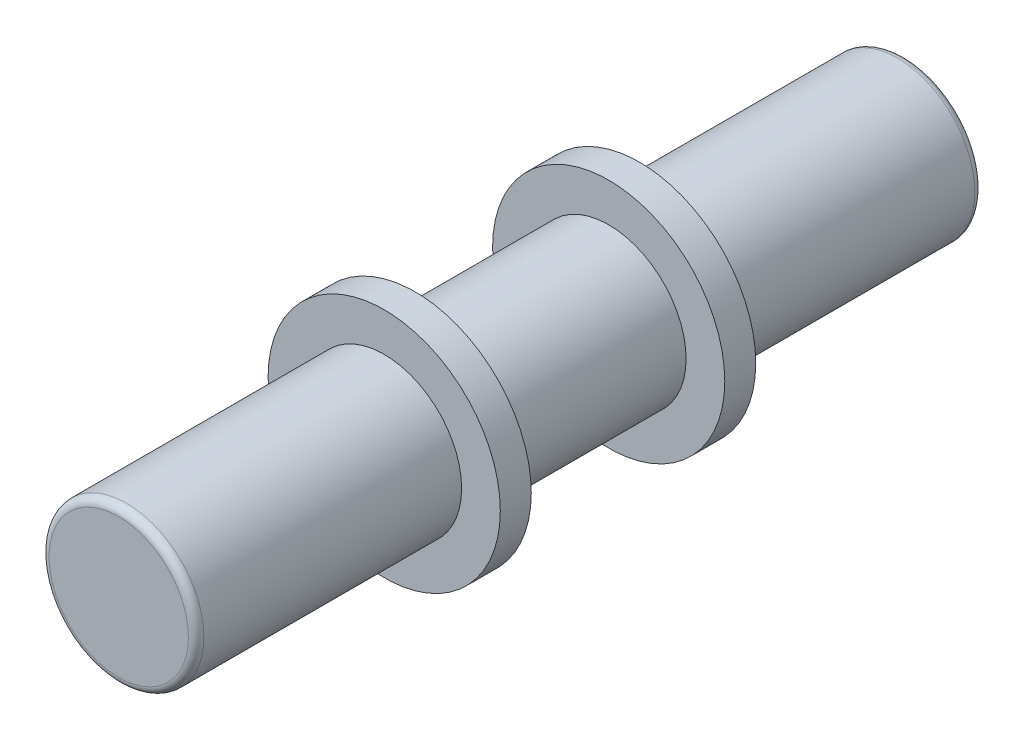
from build123d import *

# Parameters (mm, degrees)
SKETCH2_R           = 10
BOSS_EXTRUDE1_DEPTH = 12.5
SKETCH3_R           = 15
BOSS_EXTRUDE2_DEPTH = 4
SKETCH4_R           = 10
BOSS_EXTRUDE3_DEPTH = 34.3
FILLET1_R           = 1


with BuildPart() as part:
    # Sketch2 → Boss-Extrude1 (new body)
    with BuildSketch(Plane.XY):
        Circle(SKETCH2_R)
    boss_extrude1 = extrude(amount=BOSS_EXTRUDE1_DEPTH)

    # Sketch3 → Boss-Extrude2 (add)
    with BuildSketch(Plane.XY.offset(12.5)):
        Circle(SKETCH3_R)
    boss_extrude2 = extrude(amount=BOSS_EXTRUDE2_DEPTH)

    # Sketch4 → Boss-Extrude3 (add)
    with BuildSketch(Plane.XY.offset(16.5)):
        Circle(SKETCH4_R)
    boss_extrude3 = extrude(amount=BOSS_EXTRUDE3_DEPTH)

    # Mirror1: Boss-Extrude1, Boss-Extrude2, Boss-Extrude3 across plane
    add(boss_extrude1.mirror(Plane.XY))
    add(boss_extrude2.mirror(Plane.XY))
    add(boss_extrude3.mirror(Plane.XY))

    # Fillet1
    fillet1_edges = [part.edges().sort_by_distance(p)[0] for p in [
        (-10, 0, 50.8),
        (-10, 0, -50.8),
    ]]
    fillet(fillet1_edges, radius=FILLET1_R)


solid = part.part
